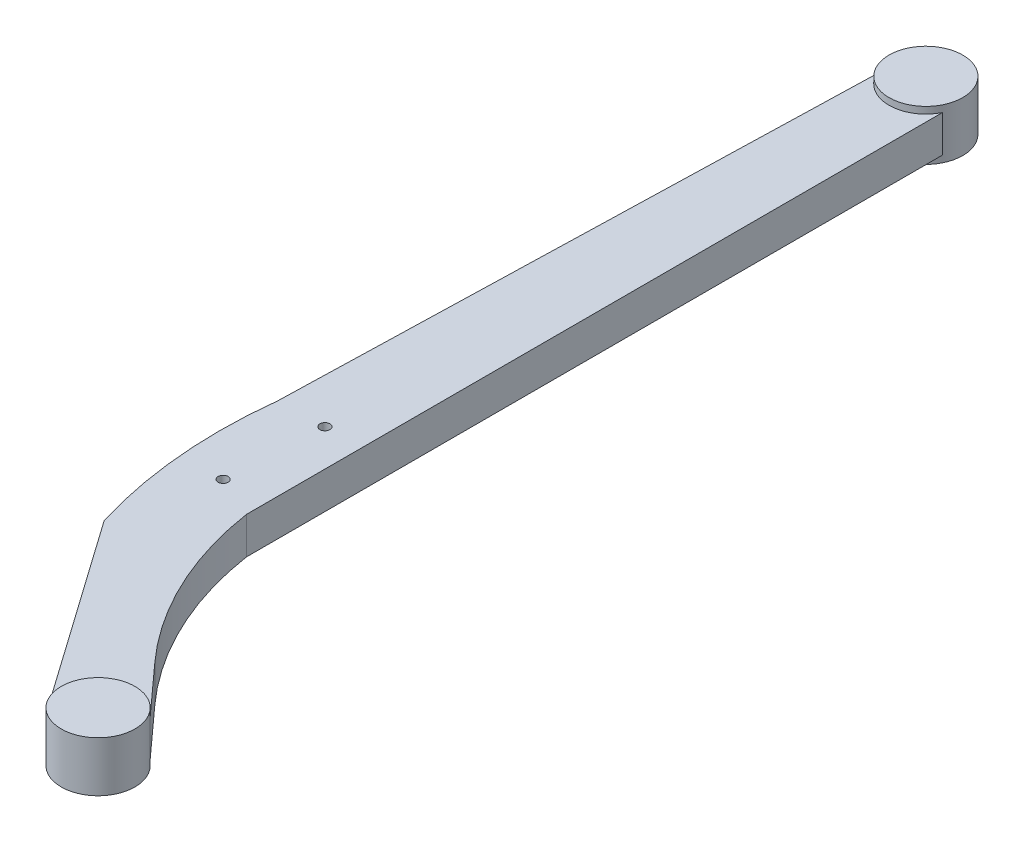
from build123d import *

# Parameters (mm, degrees)
BOSS_EXTRUDE1_DEPTH      = 55
BOSS_EXTRUDE2_DEPTH      = 10
BOSS_EXTRUDE2_DEPTH_BACK = 65
SKETCH2_R                = 55
SKETCH3_R                = 7.522289104
CUT_EXTRUDE1_DEPTH       = 1000.987090528


with BuildPart() as part:
    # Sketch1 → Boss-Extrude1 (new body)
    with BuildSketch(Plane(origin=(0, 0, 0), x_dir=(1, 0, 0), z_dir=(0, 1, 0))):
        with BuildLine():
            Line((0, -140.97167407), (0, 921.782563534))
            Line((0, 921.782563534), (-98.380397364, 921.782563534))
            Line((-98.380397364, 921.782563534), (-123.405755698, 28.326097488))
            ThreePointArc((-123.405755698, 28.326097488), (-125.417562899, -114.522053174), (-98.380397364, -254.80260491))
            Line((-98.380397364, -254.80260491), (108.641172319, -548.724400702))
            Line((108.641172319, -548.724400702), (189.500983305, -474.147655215))
            Line((189.500983305, -474.147655215), (123.733893044, -401.532470648))
            ThreePointArc((123.733893044, -401.532470648), (42.669425171, -280.368501556), (0, -140.97167407))
        make_face()
    extrude(amount=BOSS_EXTRUDE1_DEPTH)

    # Sketch2 → Boss-Extrude2 (add, two sides: drawn at the far end of the back side and taken through both)
    with BuildSketch(Plane(origin=(0, 55, 0), x_dir=(1, 0, 0), z_dir=(0, 1, 0)).offset(-BOSS_EXTRUDE2_DEPTH_BACK)):
        with Locations(Location((149.071077812, -511.436027959, 0), (0, 0, 270))):
            Circle(SKETCH2_R)
        with Locations(Location((-49.190198682, 921.782563534, 0), (0, 0, 270))):
            Circle(SKETCH2_R)
    extrude(amount=BOSS_EXTRUDE2_DEPTH + BOSS_EXTRUDE2_DEPTH_BACK)

    # Sketch3 → Cut-Extrude1 (cut, through all)
    with BuildSketch(Plane(origin=(0, 55, 0), x_dir=(1, 0, 0), z_dir=(0, 1, 0))):
        with Locations(Location((-54.735242724, 30.764070808, 0), (0, 0, 270))):
            Circle(SKETCH3_R)
        with Locations(Location((-62.623286792, -113.195627247, 0), (0, 0, 270))):
            Circle(SKETCH3_R)
    extrude(amount=-CUT_EXTRUDE1_DEPTH, mode=Mode.SUBTRACT)


solid = part.part
